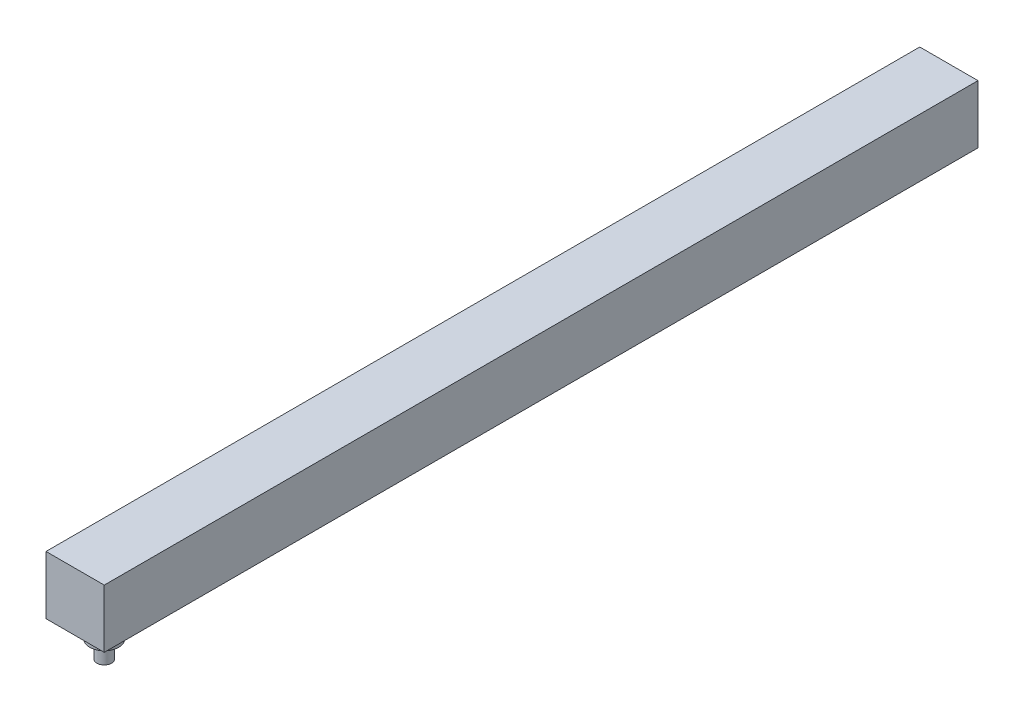
from build123d import *

# Parameters (mm, degrees)
SKETCH1_W           = 10
SKETCH1_H           = 10
BOSS_EXTRUDE1_DEPTH = 150
SKETCH2_R           = 2.5
BOSS_EXTRUDE2_DEPTH = 3
SKETCH3_R           = 1.25
BOSS_EXTRUDE3_DEPTH = 6


with BuildPart() as part:
    # Sketch1 → Boss-Extrude1 (new body)
    with BuildSketch(Plane.XY):
        with Locations((5, -5)):
            Rectangle(SKETCH1_W, SKETCH1_H)
    extrude(amount=BOSS_EXTRUDE1_DEPTH)

    # Sketch2 → Boss-Extrude2 (add)
    with BuildSketch(Plane.XZ.offset(10)):
        with Locations(Location((5, 145, 0), (0, 0, 90))):
            Circle(SKETCH2_R)
    extrude(amount=BOSS_EXTRUDE2_DEPTH)

    # Sketch3 → Boss-Extrude3 (add)
    with BuildSketch(Plane.XZ.offset(10)):
        with Locations(Location((5, 145, 0), (0, 0, 270))):
            Circle(SKETCH3_R)
    extrude(amount=BOSS_EXTRUDE3_DEPTH)


solid = part.part
